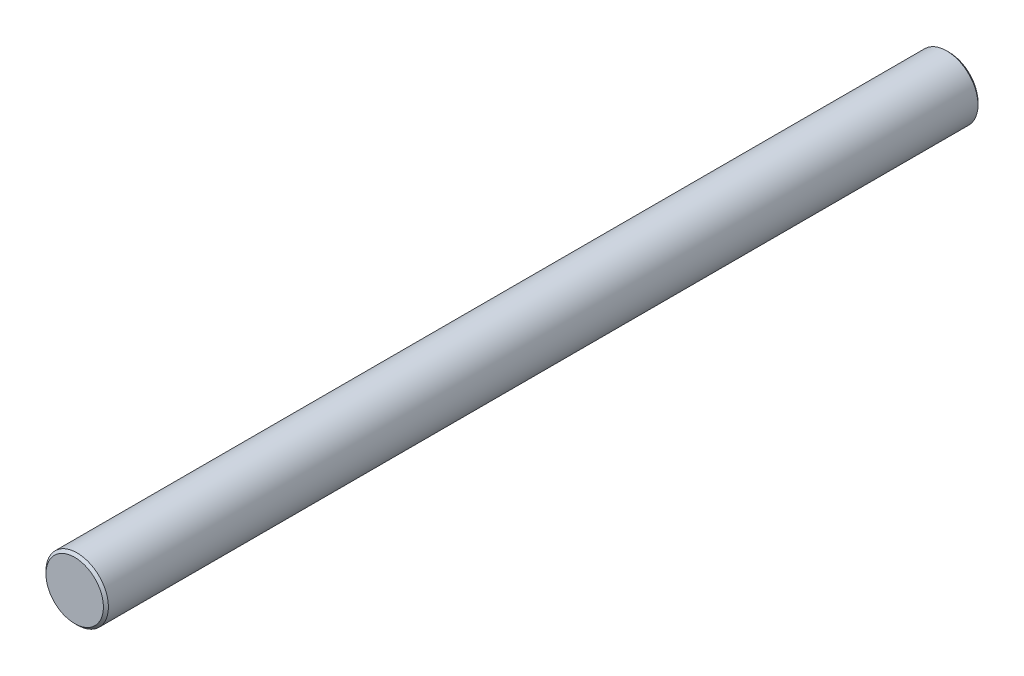
from build123d import *

# Parameters (mm, degrees)
SKETCH_1_R      = 2.5
EXTRUDE_1_DEPTH = 70
CHAMFER_1_SIZE  = 0.2


with BuildPart() as part:
    # Эскиз1 → Бобышка-Вытянуть1 (new body)
    with BuildSketch(Plane.XY):
        Circle(SKETCH_1_R)
    extrude(amount=EXTRUDE_1_DEPTH)

    # Фаска1
    chamfer_1_edges = [part.edges().sort_by_distance(p)[0] for p in [
        (-2.5, 0, 0),
        (-2.5, 0, 70),
    ]]
    chamfer(chamfer_1_edges, length=CHAMFER_1_SIZE)


solid = part.part
